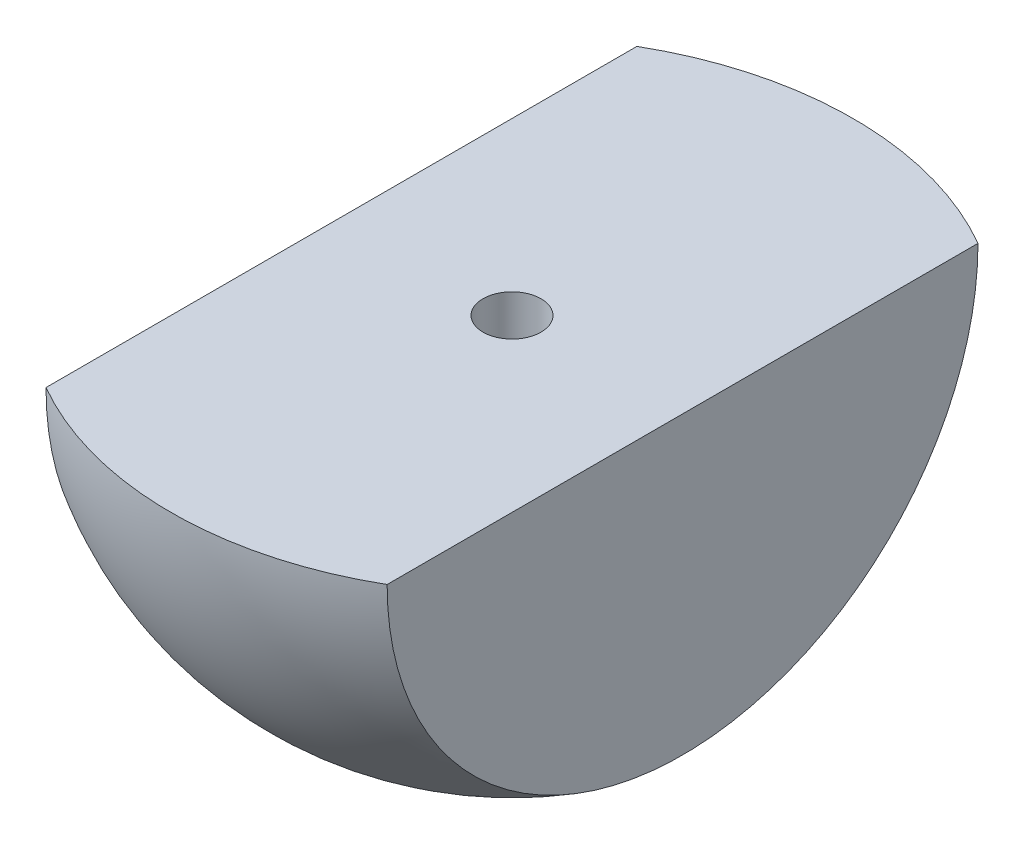
from build123d import *

# Parameters (mm, degrees)
REVOLVE1_ANGLE                 = 180
SKETCH2_W                      = 20
SKETCH2_H                      = 45
CUT_EXTRUDE1_DEPTH             = 35.641016151
CBORE_FOR_M3_SHCS1_D           = 3.4
CBORE_FOR_M3_SHCS1_CBORE_D     = 6.5
CBORE_FOR_M3_SHCS1_CBORE_DEPTH = 4


with BuildPart() as part:
    # Sketch1 → Revolve1 (revolve)
    with BuildSketch(Plane(origin=(0, 0, 0), x_dir=(1, 0, 0), z_dir=(0, 1, 0))):
        with BuildLine():
            Line((20, 0), (-20, 0))
            ThreePointArc((-20, 0), (0, 20), (20, 0))
        make_face()
    revolve(axis=Axis((20, 0, 0), (-1, 0, 0)), revolution_arc=REVOLVE1_ANGLE)

    # Sketch2 → Cut-Extrude1 (cut, through all)
    with BuildSketch(Plane(origin=(0, 0, 0), x_dir=(1, 0, 0), z_dir=(0, 1, 0))):
        with Locations((-20, 0)):
            Rectangle(SKETCH2_W, SKETCH2_H)
        with Locations((20, 0)):
            Rectangle(SKETCH2_W, SKETCH2_H)
    extrude(amount=-CUT_EXTRUDE1_DEPTH, mode=Mode.SUBTRACT)

    # CBORE for M3 SHCS1 (through all)
    with Locations(Plane(origin=(0, -20, 0), x_dir=(0, 0, -1), z_dir=(0, -1, 0))):
        with Locations((0, 0)):
            CounterBoreHole(CBORE_FOR_M3_SHCS1_D / 2, CBORE_FOR_M3_SHCS1_CBORE_D / 2, CBORE_FOR_M3_SHCS1_CBORE_DEPTH)


solid = part.part
